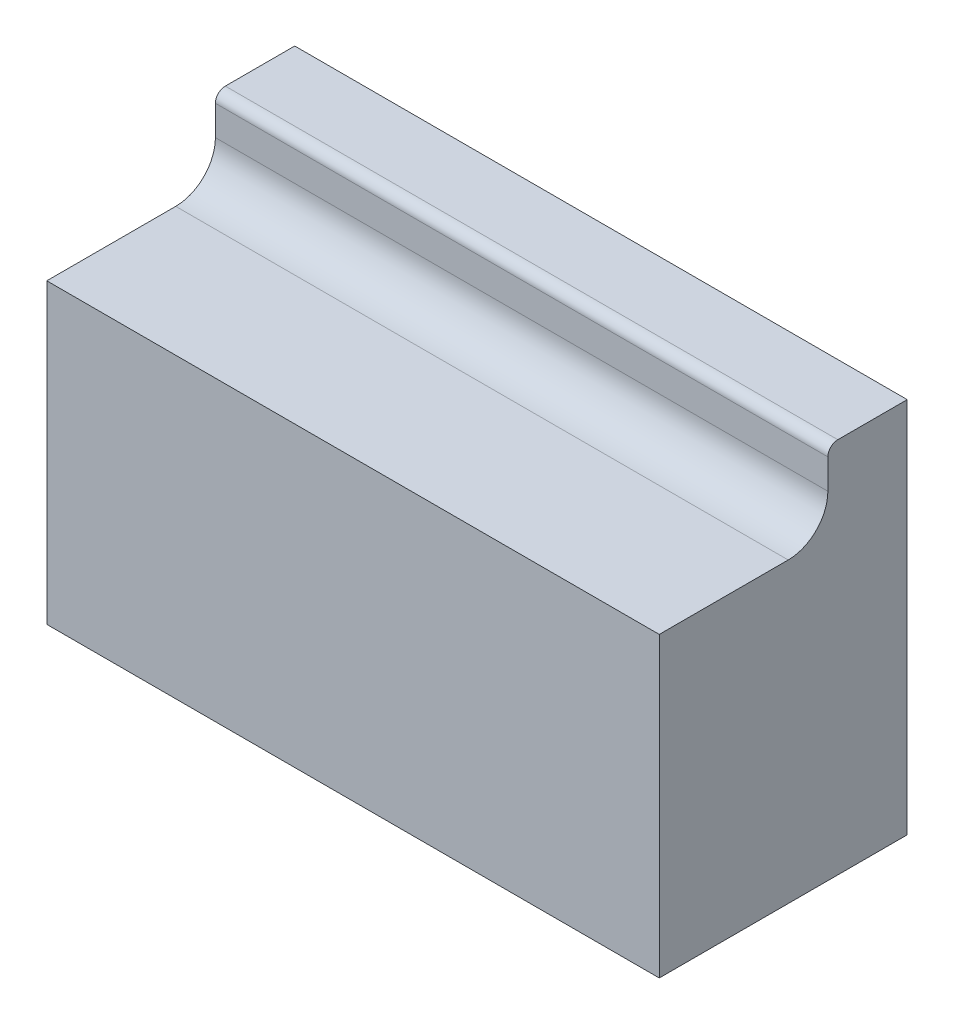
from build123d import *

# Parameters (mm, degrees)
SKETCH1_W             = 61.75
SKETCH1_H             = 38
BOSS_EXTRUDE1_DEPTH   = 12.5
CUT_EXTRUDE1_REACH    = 75.575
FILLET1_R             = 1
M6_TAPPED_HOLE1_D     = 5
M6_TAPPED_HOLE1_DEPTH = 17
M6_TAPPED_HOLE1_TIP   = 1.502151548


with BuildPart() as part:
    # Sketch1 → Boss-Extrude1 (new, symmetric)
    with BuildSketch(Plane.XY):
        with Locations((36.590437788, -19)):
            Rectangle(SKETCH1_W, SKETCH1_H)
    extrude(amount=BOSS_EXTRUDE1_DEPTH, both=True)

    # Sketch2 → Cut-Extrude1 (cut, up to next)
    with BuildSketch(Plane(origin=(67.465437788, 0, 0), x_dir=(0, 0, -1), z_dir=(1, 0, 0)), mode=Mode.PRIVATE) as cut_extrude1_sk1:
        with BuildLine():
            Line((-12.5, -8), (0.500009615, -8))
            ThreePointArc((0.500009615, -8), (3.32843674, -6.828427125), (4.500009615, -4))
            Line((4.500009615, -4), (4.500009615, 0))
            Line((4.500009615, 0), (-12.5, 0))
            Line((-12.5, 0), (-12.5, -8))
        make_face()
    cut_extrude1_tool1 = extrude(cut_extrude1_sk1.sketch, amount=-CUT_EXTRUDE1_REACH, mode=Mode.PRIVATE) & part.part
    add(cut_extrude1_tool1.solids().sort_by_distance((67.465438, -3.919537, 4.197013))[0], mode=Mode.SUBTRACT)

    # Fillet1
    fillet1_edges = [part.edges().sort_by_distance(p)[0] for p in [
        (36.590437788, 0, -4.500009615),
    ]]
    fillet(fillet1_edges, radius=FILLET1_R)

    # M6 Tapped Hole1
    with Locations(Plane(origin=(0, -38, 0), x_dir=(-1, 0, 0), z_dir=(0, -1, 0))):
        with Locations((-57.590437788, 0), (-15.590437788, 0)):
            Hole(M6_TAPPED_HOLE1_D / 2, depth=M6_TAPPED_HOLE1_DEPTH)
            with Locations((0, 0, -(M6_TAPPED_HOLE1_DEPTH + M6_TAPPED_HOLE1_TIP / 2))):  # 118° drill point
                Cone(0, M6_TAPPED_HOLE1_D / 2, M6_TAPPED_HOLE1_TIP, mode=Mode.SUBTRACT)


solid = part.part
